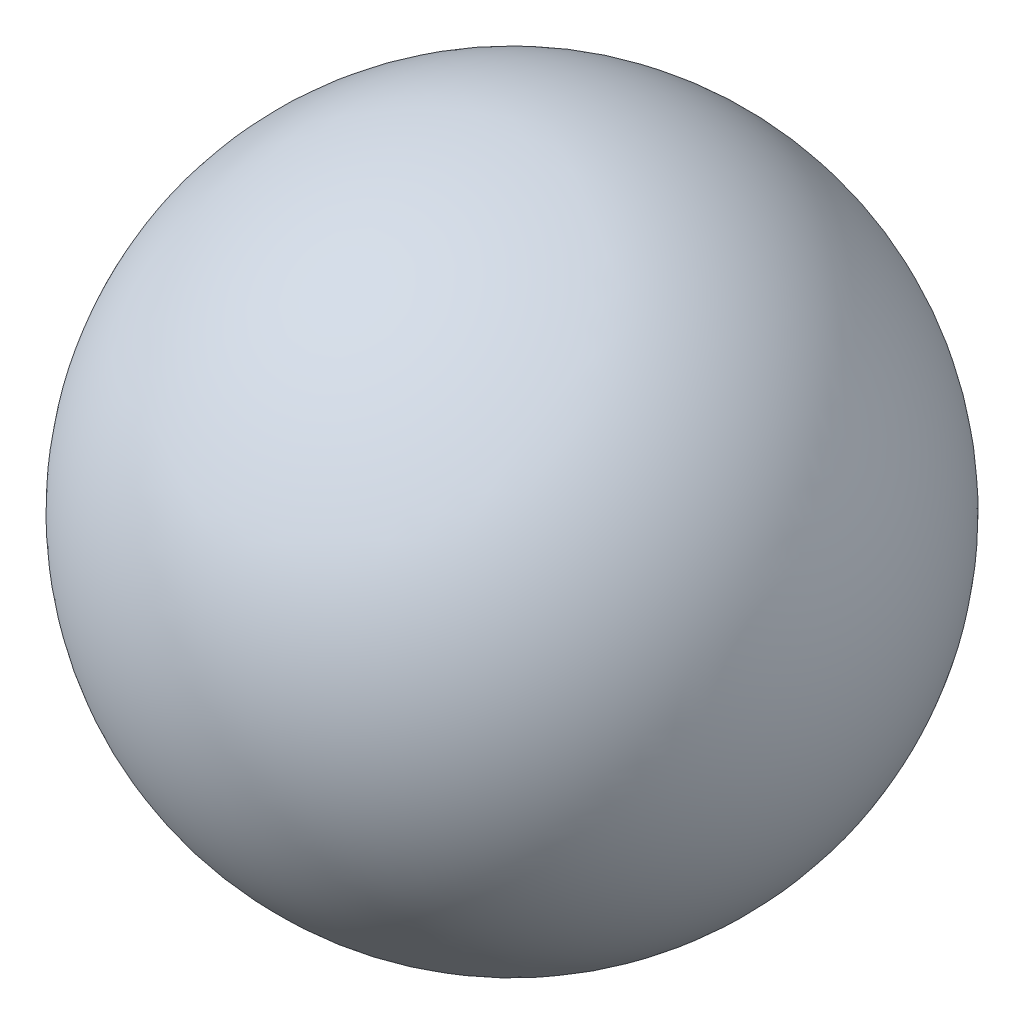
from build123d import *


with BuildPart() as part:
    # Sketch2 → Revolve1 (revolve)
    with BuildSketch(Plane(origin=(0, 0, 0), x_dir=(1, 0, 0), z_dir=(0, 1, 0))):
        with BuildLine():
            Line((-34.925, 0), (34.925, 0))
            ThreePointArc((34.925, 0), (0, -34.925), (-34.925, 0))
        make_face()
    revolve(axis=Axis((-34.925, 0, 0), (1, 0, 0)))


solid = part.part
